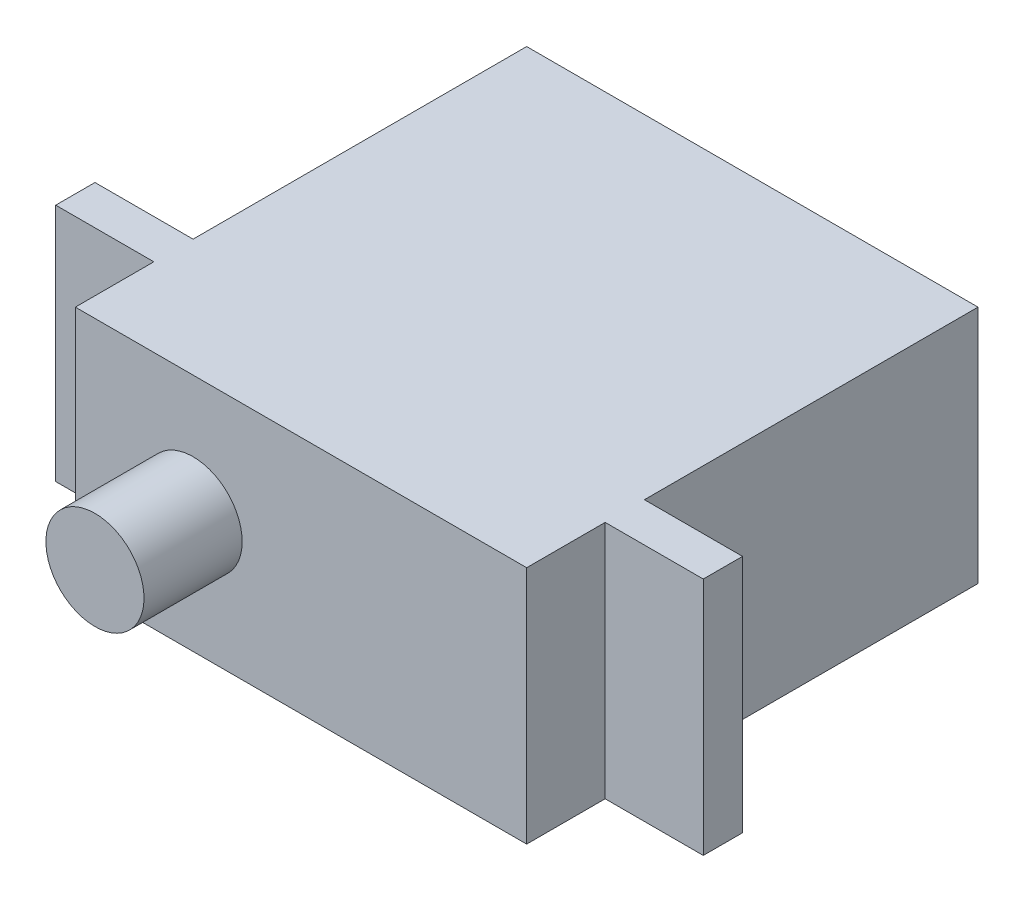
from build123d import *

# Parameters (mm, degrees)
CASE_23X12P2X23_START                = -19
CASE_23X12P2X23_PROFILE_W            = 23
CASE_23X12P2X23_PROFILE_H            = 12.2
CASE_23X12P2X23_DEPTH                = 23
MOUNTING_EARS_33X12P2_START          = -2
MOUNTING_EARS_33X12P2_PROFILE_W      = 33
MOUNTING_EARS_33X12P2_PROFILE_H      = 12.2
MOUNTING_EARS_33X12P2_DEPTH          = 2
OUTPUT_ENVELOPE_NOT_SPLINE_START     = 4
OUTPUT_ENVELOPE_NOT_SPLINE_PROFILE_R = 2.5
OUTPUT_ENVELOPE_NOT_SPLINE_DEPTH     = 5


with BuildPart() as part:
    # Case_23x12p2x23_profile → Case_23x12p2x23 (new body)
    with BuildSketch(Plane.XY.offset(CASE_23X12P2X23_START)):
        with Locations((5.5, 0)):
            Rectangle(CASE_23X12P2X23_PROFILE_W, CASE_23X12P2X23_PROFILE_H)
    extrude(amount=CASE_23X12P2X23_DEPTH)

    # Mounting_ears_33x12p2_profile → Mounting_ears_33x12p2 (add)
    with BuildSketch(Plane.XY.offset(MOUNTING_EARS_33X12P2_START)):
        with Locations((5.5, 0)):
            Rectangle(MOUNTING_EARS_33X12P2_PROFILE_W, MOUNTING_EARS_33X12P2_PROFILE_H)
    extrude(amount=MOUNTING_EARS_33X12P2_DEPTH)

    # Output_envelope_not_spline_profile → Output_envelope_not_spline (add)
    with BuildSketch(Plane.XY.offset(OUTPUT_ENVELOPE_NOT_SPLINE_START)):
        Circle(OUTPUT_ENVELOPE_NOT_SPLINE_PROFILE_R)
    extrude(amount=OUTPUT_ENVELOPE_NOT_SPLINE_DEPTH)


solid = part.part
